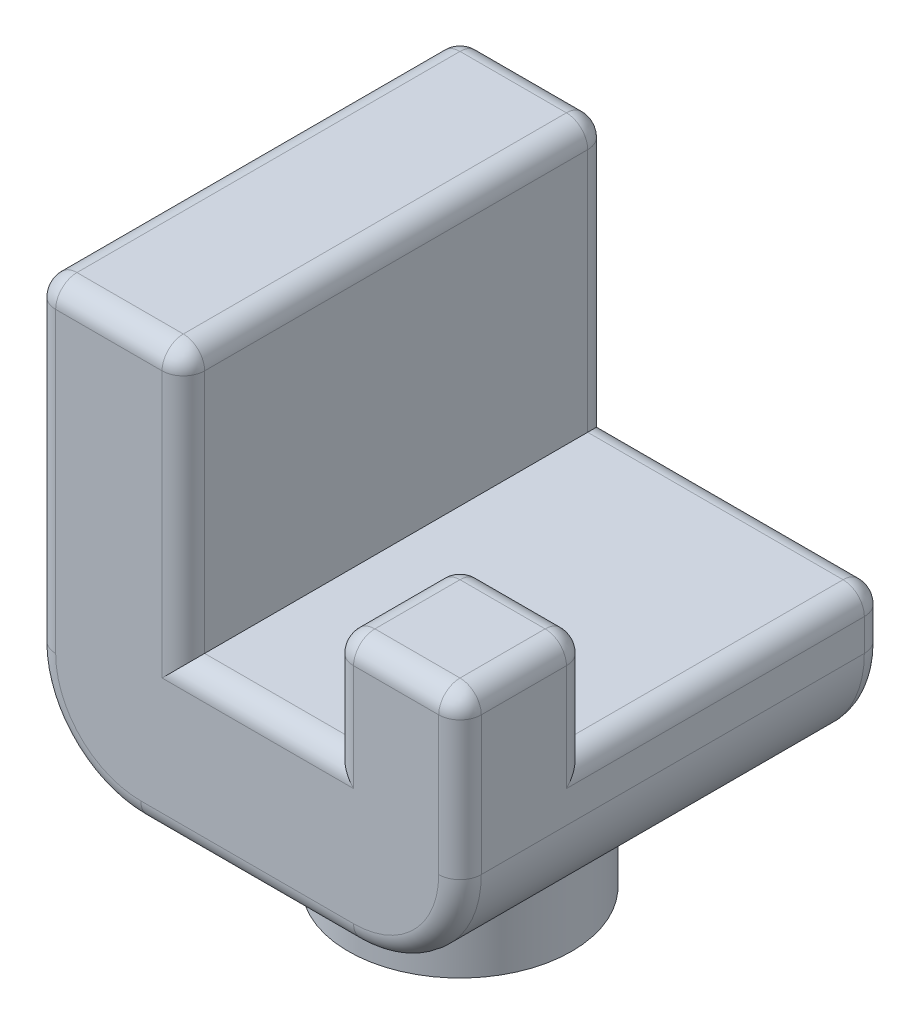
from build123d import *

# Parameters (mm, degrees)
SKETCH1_W           = 20
SKETCH1_H           = 20
BOSS_EXTRUDE1_DEPTH = 20
CUT_EXTRUDE1_DEPTH  = 25
SKETCH3_W           = 14
SKETCH3_H           = 5
CUT_EXTRUDE2_DEPTH  = 13
FILLET1_R           = 5
FILLET2_R           = 1
FILLET3_R           = 1
SKETCH4_R           = 5.25
BOSS_EXTRUDE2_DEPTH = 5


with BuildPart() as part:
    # Sketch1 → Boss-Extrude1 (new body)
    with BuildSketch(Plane.XY):
        Rectangle(SKETCH1_W, SKETCH1_H)
    extrude(amount=BOSS_EXTRUDE1_DEPTH)

    # Sketch2 → Cut-Extrude1 (cut)
    with BuildSketch(Plane.XY.offset(20)):
        Polygon((4, 2.5), (4, -2.5), (-3, -2.5), (-3, 10), (10, 10), (10, 2.5), align=None)
    extrude(amount=-CUT_EXTRUDE1_DEPTH, mode=Mode.SUBTRACT)

    # Sketch3 → Cut-Extrude2 (cut)
    with BuildSketch(Plane(origin=(10, 0, 0), x_dir=(0, 0, -1), z_dir=(1, 0, 0))):
        with Locations((-7, 0)):
            Rectangle(SKETCH3_W, SKETCH3_H)
    extrude(amount=-CUT_EXTRUDE2_DEPTH, mode=Mode.SUBTRACT)

    # Fillet1
    fillet1_edges = [part.edges().sort_by_distance(p)[0] for p in [
        (10, -10, 10),
        (-10, -10, 10),
    ]]
    fillet(fillet1_edges, radius=FILLET1_R)

    # Fillet2
    fillet2_edges = [part.edges().sort_by_distance(p)[0] for p in [
        (-10, 2.5, 20),
        (-3, 3.75, 0),
        (-3, 3.75, 20),
        (4, 0, 20),
        (4, 0, 14),
        (10, 0, 14),
        (-10, 2.5, 0),
        (10, -1.25, 20),
        (10, -3.75, 0),
        (0, -10, 0),
        (-8.535533906, -8.535533906, 0),
        (8.535533906, -8.535533906, 0),
        (0, -10, 20),
        (-8.535533906, -8.535533906, 20),
        (8.535533906, -8.535533906, 20),
    ]]
    fillet(fillet2_edges, radius=FILLET2_R)

    # Fillet3
    fillet3_edges = [part.edges().sort_by_distance(p)[0] for p in [
        (2.5, -2.5, 0),
        (9.707106781, -2.5, 0.292893219),
        (10, -2.5, 8),
        (9.707106781, 2.5, 19.707106781),
        (10, 2.5, 17),
        (9.707106781, 2.5, 14.292893219),
        (7, 2.5, 14),
        (4.292893219, 2.5, 14.292893219),
        (4, 2.5, 17),
        (4.292893219, 2.5, 19.707106781),
        (7, 2.5, 20),
        (0.5, -2.5, 20),
        (-3.292893219, 10, 0.292893219),
        (-9.707106781, 10, 0.292893219),
        (-6.5, 10, 0),
        (-3, 10, 10),
        (-3.292893219, 10, 19.707106781),
        (-9.707106781, 10, 19.707106781),
        (-6.5, 10, 20),
        (-10, 10, 10),
    ]]
    fillet(fillet3_edges, radius=FILLET3_R)

    # Sketch4 → Boss-Extrude2 (add)
    with BuildSketch(Plane.XZ.offset(10)):
        with Locations(Location((0, 10, 0), (0, 0, 17.752790162))):
            Circle(SKETCH4_R)
    extrude(amount=BOSS_EXTRUDE2_DEPTH)


solid = part.part
